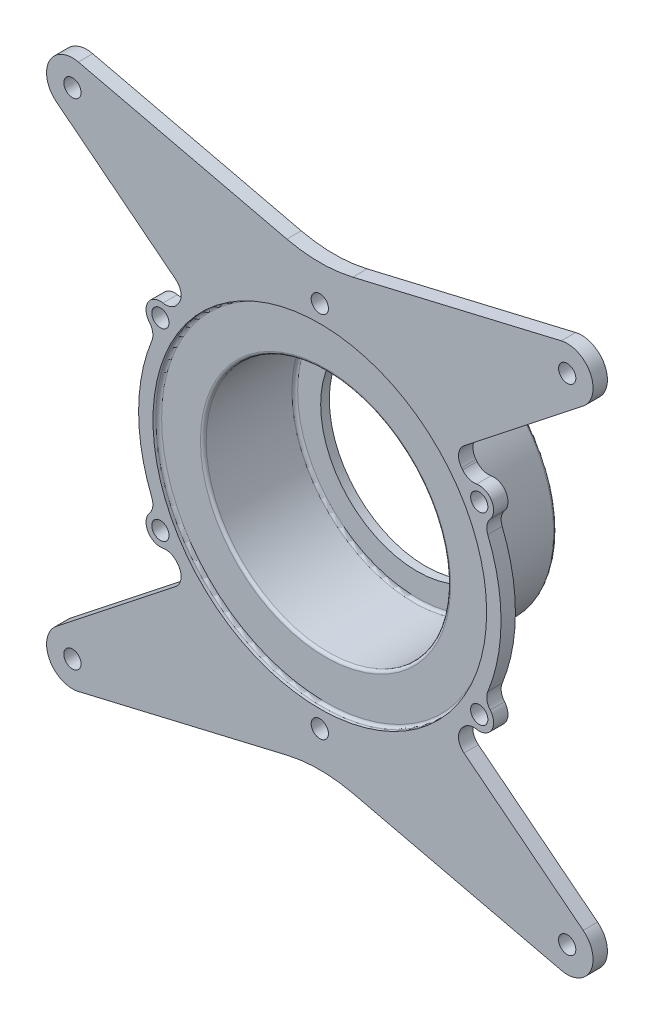
from build123d import *

# Parameters (mm, degrees)
SKETCH3_R           = 3
BOSS_EXTRUDE1_DEPTH = 5
CUT_EXTRUDE1_REACH  = 140.062
SKETCH4_R           = 3
FILLET1_R           = 1
FILLET2_R           = 5
FILLET3_R           = 5


with BuildPart() as part:
    # Sketch2 → Revolve1 (revolve)
    with BuildSketch(Plane(origin=(0, 0, 0), x_dir=(0, 0, -1), z_dir=(1, 0, 0)), mode=Mode.PRIVATE) as revolve1_sk:
        Polygon((10.325729927, 42.5), (42.125729927, 42.5), (42.125729927, 33.5), (45.125729927, 33.5), (45.125729927, 45.5), (13.325729927, 45.5), (13.325729927, 63), (8.325729927, 63), (8.325729927, 58), (10.325729927, 58), align=None)
    revolve(revolve1_sk.sketch.rotate(Axis((0, 0, 59.953467153), (0, 0, -1)), 90), axis=Axis((0, 0, 59.953467153), (0, 0, -1)))

    # Sketch3 → Boss-Extrude1 (add)
    # profile 1 of 6: a face of its own
    with BuildSketch(Plane.XY.offset(-8.325729927)):
        with BuildLine():
            ThreePointArc((-11.461894453, -77.691798172), (0, -76.360319575), (11.461894453, -77.691798172))
            Line((11.461894453, -77.691798172), (83.936858998, -94.760333853))
            ThreePointArc((83.936858998, -94.760333853), (94.106133519, -89.910319599), (91.57211782, -78.932362276))
            Line((91.57211782, -78.932362276), (46.023219274, -43.02166068))
            ThreePointArc((46.023219274, -43.02166068), (0, -63), (-46.023219274, -43.02166068))
            Line((-46.023219274, -43.02166068), (-91.57211782, -78.932362276))
            ThreePointArc((-91.57211782, -78.932362276), (-94.106133519, -89.910319599), (-83.936858998, -94.760333853))
            Line((-83.936858998, -94.760333853), (-11.461894453, -77.691798172))
        make_face()
        with Locations((-86, -86)):
            Circle(SKETCH3_R, mode=Mode.SUBTRACT)
        with Locations((86, -86)):
            Circle(SKETCH3_R, mode=Mode.SUBTRACT)
    # profile 2 of 6: a face of its own
    with BuildSketch(Plane.XY.offset(-8.325729927)):
        with BuildLine():
            ThreePointArc((51.968751829, -35.612481426), (59.755752861, -34.5), (56.825689522, -27.200018574))
            ThreePointArc((56.825689522, -27.200018574), (54.559600438, -31.5), (51.968751829, -35.612481426))
        make_face()
    # profile 3 of 6: a face of its own
    with BuildSketch(Plane.XY.offset(-8.325729927)):
        with BuildLine():
            ThreePointArc((-56.825689522, -27.200018574), (-59.755752861, -34.5), (-51.968751829, -35.612481426))
            ThreePointArc((-51.968751829, -35.612481426), (-54.559600438, -31.5), (-56.825689522, -27.200018574))
        make_face()
    # profile 4 of 6: a face of its own
    with BuildSketch(Plane.XY.offset(-8.325729927)):
        with BuildLine():
            ThreePointArc((-51.968751829, 35.612481426), (-59.755752861, 34.5), (-56.825689522, 27.200018574))
            ThreePointArc((-56.825689522, 27.200018574), (-54.559600438, 31.5), (-51.968751829, 35.612481426))
        make_face()
    # profile 5 of 6: a face of its own
    with BuildSketch(Plane.XY.offset(-8.325729927)):
        with BuildLine():
            ThreePointArc((56.825689522, 27.200018574), (59.755752861, 34.5), (51.968751829, 35.612481426))
            ThreePointArc((51.968751829, 35.612481426), (54.559600438, 31.5), (56.825689522, 27.200018574))
        make_face()
    # profile 6 of 6: a face of its own
    with BuildSketch(Plane.XY.offset(-8.325729927)):
        with BuildLine():
            Line((-91.57211782, 78.932362276), (-46.023219274, 43.02166068))
            ThreePointArc((-46.023219274, 43.02166068), (0, 63), (46.023219274, 43.02166068))
            Line((46.023219274, 43.02166068), (91.57211782, 78.932362276))
            ThreePointArc((91.57211782, 78.932362276), (94.106133519, 89.910319599), (83.936858998, 94.760333853))
            Line((83.936858998, 94.760333853), (11.461894453, 77.691798172))
            ThreePointArc((11.461894453, 77.691798172), (0, 76.360319575), (-11.461894453, 77.691798172))
            Line((-11.461894453, 77.691798172), (-83.936858998, 94.760333853))
            ThreePointArc((-83.936858998, 94.760333853), (-94.106133519, 89.910319599), (-91.57211782, 78.932362276))
        make_face()
        with Locations((-86, 86)):
            Circle(SKETCH3_R, mode=Mode.SUBTRACT)
        with Locations((86, 86)):
            Circle(SKETCH3_R, mode=Mode.SUBTRACT)
    extrude(amount=-BOSS_EXTRUDE1_DEPTH)

    # Sketch4 → Cut-Extrude1 (cut, up to next)
    with BuildSketch(Plane(origin=(0, 0, -13.325729927), x_dir=(-1, 0, 0), z_dir=(0, 0, -1)), mode=Mode.PRIVATE) as cut_extrude1_sk1:
        with Locations((55.425625842, 32)):
            Circle(SKETCH4_R)
    cut_extrude1_tool1 = extrude(cut_extrude1_sk1.sketch, amount=-CUT_EXTRUDE1_REACH, mode=Mode.PRIVATE) & part.part
    # Sketch4 → Cut-Extrude1 (cut, up to next)
    with BuildSketch(Plane(origin=(0, 0, -13.325729927), x_dir=(-1, 0, 0), z_dir=(0, 0, -1)), mode=Mode.PRIVATE) as cut_extrude1_sk2:
        with Locations((55.425625842, -32)):
            Circle(SKETCH4_R)
    cut_extrude1_tool2 = extrude(cut_extrude1_sk2.sketch, amount=-CUT_EXTRUDE1_REACH, mode=Mode.PRIVATE) & part.part
    # Sketch4 → Cut-Extrude1 (cut, up to next)
    with BuildSketch(Plane(origin=(0, 0, -13.325729927), x_dir=(-1, 0, 0), z_dir=(0, 0, -1)), mode=Mode.PRIVATE) as cut_extrude1_sk3:
        with Locations((0, -64)):
            Circle(SKETCH4_R)
    cut_extrude1_tool3 = extrude(cut_extrude1_sk3.sketch, amount=-CUT_EXTRUDE1_REACH, mode=Mode.PRIVATE) & part.part
    # Sketch4 → Cut-Extrude1 (cut, up to next)
    with BuildSketch(Plane(origin=(0, 0, -13.325729927), x_dir=(-1, 0, 0), z_dir=(0, 0, -1)), mode=Mode.PRIVATE) as cut_extrude1_sk4:
        with Locations((-55.425625842, -32)):
            Circle(SKETCH4_R)
    cut_extrude1_tool4 = extrude(cut_extrude1_sk4.sketch, amount=-CUT_EXTRUDE1_REACH, mode=Mode.PRIVATE) & part.part
    # Sketch4 → Cut-Extrude1 (cut, up to next)
    with BuildSketch(Plane(origin=(0, 0, -13.325729927), x_dir=(-1, 0, 0), z_dir=(0, 0, -1)), mode=Mode.PRIVATE) as cut_extrude1_sk5:
        with Locations((-55.425625842, 32)):
            Circle(SKETCH4_R)
    cut_extrude1_tool5 = extrude(cut_extrude1_sk5.sketch, amount=-CUT_EXTRUDE1_REACH, mode=Mode.PRIVATE) & part.part
    # Sketch4 → Cut-Extrude1 (cut, up to next)
    with BuildSketch(Plane(origin=(0, 0, -13.325729927), x_dir=(-1, 0, 0), z_dir=(0, 0, -1)), mode=Mode.PRIVATE) as cut_extrude1_sk6:
        with Locations((0, 64)):
            Circle(SKETCH4_R)
    cut_extrude1_tool6 = extrude(cut_extrude1_sk6.sketch, amount=-CUT_EXTRUDE1_REACH, mode=Mode.PRIVATE) & part.part
    add(cut_extrude1_tool1.solids().sort_by_distance((-55.425626, 32, -13.32573))[0], mode=Mode.SUBTRACT)
    add(cut_extrude1_tool2.solids().sort_by_distance((-55.425626, -32, -13.32573))[0], mode=Mode.SUBTRACT)
    add(cut_extrude1_tool3.solids().sort_by_distance((0, -64, -13.32573))[0], mode=Mode.SUBTRACT)
    add(cut_extrude1_tool4.solids().sort_by_distance((55.425626, -32, -13.32573))[0], mode=Mode.SUBTRACT)
    add(cut_extrude1_tool5.solids().sort_by_distance((55.425626, 32, -13.32573))[0], mode=Mode.SUBTRACT)
    add(cut_extrude1_tool6.solids().sort_by_distance((0, 64, -13.32573))[0], mode=Mode.SUBTRACT)

    # Fillet1
    fillet1_edges = [part.edges().sort_by_distance(p)[0] for p in [
        (-45.5, 0, -45.125729927),
        (-45.5, 0, -13.325729927),
        (-58, 0, -10.325729927),
        (-42.5, 0, -10.325729927),
        (-42.5, 0, -42.125729927),
    ]]
    fillet(fillet1_edges, radius=FILLET1_R)

    # Fillet2
    fillet2_edges = [part.edges().sort_by_distance(p)[0] for p in [
        (-46.023219274, -43.02166068, -10.825729927),
        (46.023219274, -43.02166068, -10.825729927),
        (46.023219274, 43.02166068, -10.825729927),
        (-46.023219274, 43.02166068, -10.825729927),
    ]]
    fillet(fillet2_edges, radius=FILLET2_R)

    # Fillet3
    fillet3_edges = [part.edges().sort_by_distance(p)[0] for p in [
        (-56.825689522, -27.200018574, -10.825729927),
        (-51.968751829, -35.612481426, -10.825729927),
        (51.968751829, -35.612481426, -10.825729927),
        (56.825689522, -27.200018574, -10.825729927),
        (-51.968751829, 35.612481426, -10.825729927),
        (-56.825689522, 27.200018574, -10.825729927),
        (56.825689522, 27.200018574, -10.825729927),
        (51.968751829, 35.612481426, -10.825729927),
    ]]
    fillet(fillet3_edges, radius=FILLET3_R)


solid = part.part
